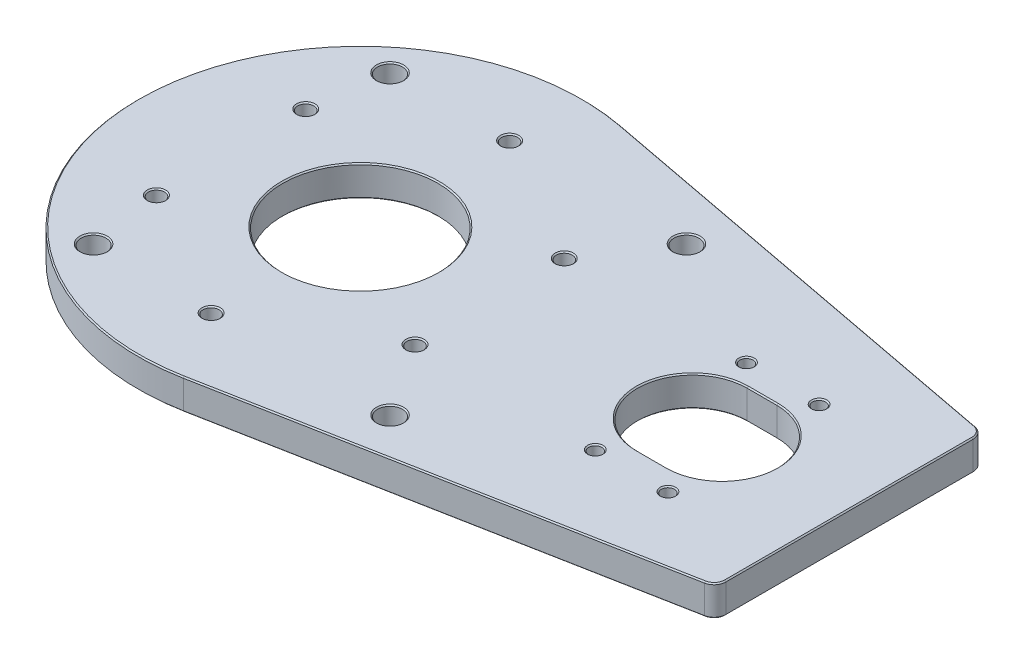
from build123d import *

# Parameters (mm, degrees)
SKETCH1_R           = 4.2
SKETCH1_R_2         = 2.7
SKETCH1_R_3         = 2.2
SKETCH1_R_4         = 26.2
BOSS_EXTRUDE1_DEPTH = 10.3
SKETCH2_R           = 5.2
CUT_EXTRUDE2_DEPTH  = 5.2
CHAMFER1_SIZE       = 0.4


with BuildPart() as part:
    # Sketch1 → Boss-Extrude1 (new body)
    with BuildSketch(Plane(origin=(0, 0, 0), x_dir=(1, 0, 0), z_dir=(0, 1, 0))):
        with BuildLine():
            Line((161.746435314, 45.617999491), (13.995662136, 73.682572169))
            ThreePointArc((13.995662136, 73.682572169), (-75, 0), (13.995662136, -73.682572169))
            Line((13.995662136, -73.682572169), (161.746435314, -45.617999491))
            ThreePointArc((161.746435314, -45.617999491), (164.081050248, -44.239169867), (165, -41.688262309))
            Line((165, -41.688262309), (165, 0))
            Line((165, 0), (165, 41.688262309))
            ThreePointArc((165, 41.688262309), (164.081050248, 44.239169867), (161.746435314, 45.617999491))
        make_face()
        with Locations(Location((-40, -50, 0), (0, 0, 90))):
            Circle(SKETCH1_R, mode=Mode.SUBTRACT)
        with Locations(Location((0, -50.35, 0), (0, 0, 90))):
            Circle(SKETCH1_R_2, mode=Mode.SUBTRACT)
        with Locations(Location((-43.604379081, -25.175, 0), (0, 0, 90))):
            Circle(SKETCH1_R_2, mode=Mode.SUBTRACT)
        with Locations(Location((43.604379081, -25.175, 0), (0, 0, 90))):
            Circle(SKETCH1_R_2, mode=Mode.SUBTRACT)
        with Locations(Location((60, -50, 0), (0, 0, 90))):
            Circle(SKETCH1_R, mode=Mode.SUBTRACT)
        with Locations(Location((104.75, -25.5, 0), (0, 0, 90))):
            Circle(SKETCH1_R_3, mode=Mode.SUBTRACT)
        with Locations(Location((129.25, -25.5, 0), (0, 0, 90))):
            Circle(SKETCH1_R_3, mode=Mode.SUBTRACT)
        with Locations(Location((-43.604379081, 25.175, 0), (0, 0, 90))):
            Circle(SKETCH1_R_2, mode=Mode.SUBTRACT)
        with Locations(Location((0, 0, 0), (0, 0, 90))):
            Circle(SKETCH1_R_4, mode=Mode.SUBTRACT)
        with Locations(Location((43.604379081, 25.175, 0), (0, 0, 90))):
            Circle(SKETCH1_R_2, mode=Mode.SUBTRACT)
        with Locations(Location((-40, 50, 0), (0, 0, 90))):
            Circle(SKETCH1_R, mode=Mode.SUBTRACT)
        with Locations(Location((0, 50.35, 0), (0, 0, 90))):
            Circle(SKETCH1_R_2, mode=Mode.SUBTRACT)
        with Locations(Location((104.75, 25.5, 0), (0, 0, 90))):
            Circle(SKETCH1_R_3, mode=Mode.SUBTRACT)
        with BuildLine():
            ThreePointArc((122, 18.5), (140.5, 0), (122, -18.5))
            Line((122, -18.5), (112, -18.5))
            ThreePointArc((112, -18.5), (93.5, 0), (112, 18.5))
            Line((112, 18.5), (122, 18.5))
        make_face(mode=Mode.SUBTRACT)
        with Locations(Location((129.25, 25.5, 0), (0, 0, 90))):
            Circle(SKETCH1_R_3, mode=Mode.SUBTRACT)
        with Locations(Location((60, 50, 0), (0, 0, 90))):
            Circle(SKETCH1_R, mode=Mode.SUBTRACT)
    extrude(amount=BOSS_EXTRUDE1_DEPTH)

    # Sketch2 → Cut-Extrude2 (cut)
    with BuildSketch(Plane.XZ):
        with Locations(Location((43.604379081, -25.175, 0), (0, 0, 270))):
            Circle(SKETCH2_R)
        with Locations(Location((0, -50.35, 0), (0, 0, 270))):
            Circle(SKETCH2_R)
        with Locations(Location((-43.604379081, -25.175, 0), (0, 0, 270))):
            Circle(SKETCH2_R)
        with Locations(Location((-43.604379081, 25.175, 0), (0, 0, 270))):
            Circle(SKETCH2_R)
        with Locations(Location((0, 50.35, 0), (0, 0, 270))):
            Circle(SKETCH2_R)
        with Locations(Location((43.604379081, 25.175, 0), (0, 0, 270))):
            Circle(SKETCH2_R)
        with Locations(Location((104.75, -25.5, 0), (0, 0, 270))):
            Circle(SKETCH2_R)
        with Locations(Location((129.25, -25.5, 0), (0, 0, 270))):
            Circle(SKETCH2_R)
        with Locations(Location((129.25, 25.5, 0), (0, 0, 270))):
            Circle(SKETCH2_R)
        with Locations(Location((104.75, 25.5, 0), (0, 0, 270))):
            Circle(SKETCH2_R)
    extrude(amount=-CUT_EXTRUDE2_DEPTH, mode=Mode.SUBTRACT)

    # Chamfer1
    chamfer1_edges = [part.edges().sort_by_distance(p)[0] for p in [
        (-43.604379081, 5.2, -22.475),
        (164.081050248, 10.3, 44.239169867),
        (-43.604379081, 0, -19.975),
        (0, 5.2, -47.65),
        (0, 0, -45.15),
        (165, 10.3, 0),
        (104.75, 0, -20.3),
        (104.75, 5.2, -23.3),
        (104.75, 5.2, 27.7),
        (104.75, 0, 30.7),
        (164.081050248, 10.3, -44.239169867),
        (43.604379081, 5.2, -22.475),
        (43.604379081, 0, -19.975),
        (87.871048725, 10.3, -59.65028583),
        (-75, 10.3, 0),
        (0, 10.3, 26.2),
        (-43.604379081, 10.3, -22.475),
        (-75, 0, 0),
        (87.871048725, 0, -59.65028583),
        (164.081050248, 0, -44.239169867),
        (60, 10.3, -45.8),
        (165, 0, 0),
        (164.081050248, 0, 44.239169867),
        (87.871048725, 0, 59.65028583),
        (-40, 0, -45.8),
        (117, 0, 18.5),
        (140.5, 0, 0),
        (0, 10.3, 53.05),
        (117, 0, -18.5),
        (93.5, 0, 0),
        (-40, 0, 54.2),
        (60, 10.3, 54.2),
        (60, 0, 54.2),
        (60, 0, -45.8),
        (0, 0, 26.2),
        (43.604379081, 10.3, 27.875),
        (-40, 10.3, 54.2),
        (43.604379081, 10.3, -22.475),
        (0, 10.3, -47.65),
        (129.25, 10.3, -23.3),
        (129.25, 10.3, 27.7),
        (104.75, 10.3, 27.7),
        (93.5, 10.3, 0),
        (117, 10.3, -18.5),
        (140.5, 10.3, 0),
        (117, 10.3, 18.5),
        (104.75, 10.3, -23.3),
        (129.25, 5.2, 27.7),
        (129.25, 0, 30.7),
        (-43.604379081, 10.3, 27.875),
        (129.25, 0, -20.3),
        (129.25, 5.2, -23.3),
        (43.604379081, 5.2, 27.875),
        (43.604379081, 0, 30.375),
        (-40, 10.3, -45.8),
        (0, 5.2, 53.05),
        (0, 0, 55.55),
        (87.871048725, 10.3, 59.65028583),
        (-43.604379081, 5.2, 27.875),
        (-43.604379081, 0, 30.375),
    ]]
    chamfer(chamfer1_edges, length=CHAMFER1_SIZE)


solid = part.part
